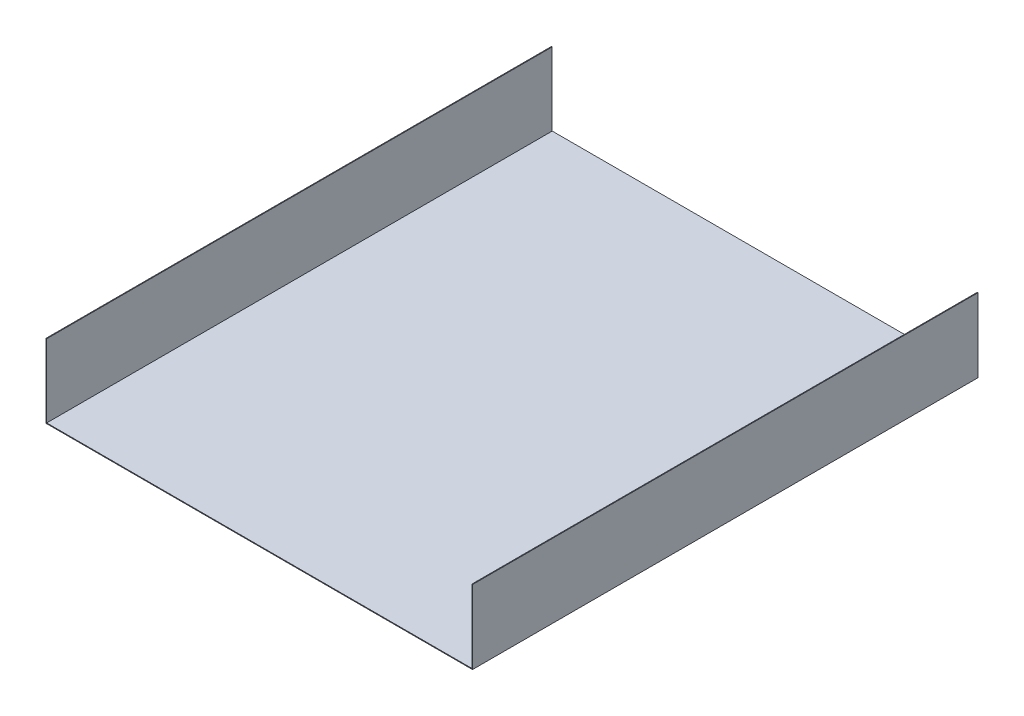
from build123d import *

# Parameters (mm, degrees)
CEK_ICECEK_KUTU_U_1_0_1_DEPTH = 700


with BuildPart() as part:
    # Sketch1 → CEK_icecek_kutu_U_1.0_1 (new body)
    with BuildSketch(Plane.XY):
        Polygon((13.7, 106), (13.7, 4), (604.3, 4), (604.3, 106), (603.3, 106), (603.3, 5), (14.7, 5), (14.7, 106), align=None)
    extrude(amount=-CEK_ICECEK_KUTU_U_1_0_1_DEPTH)


solid = part.part
